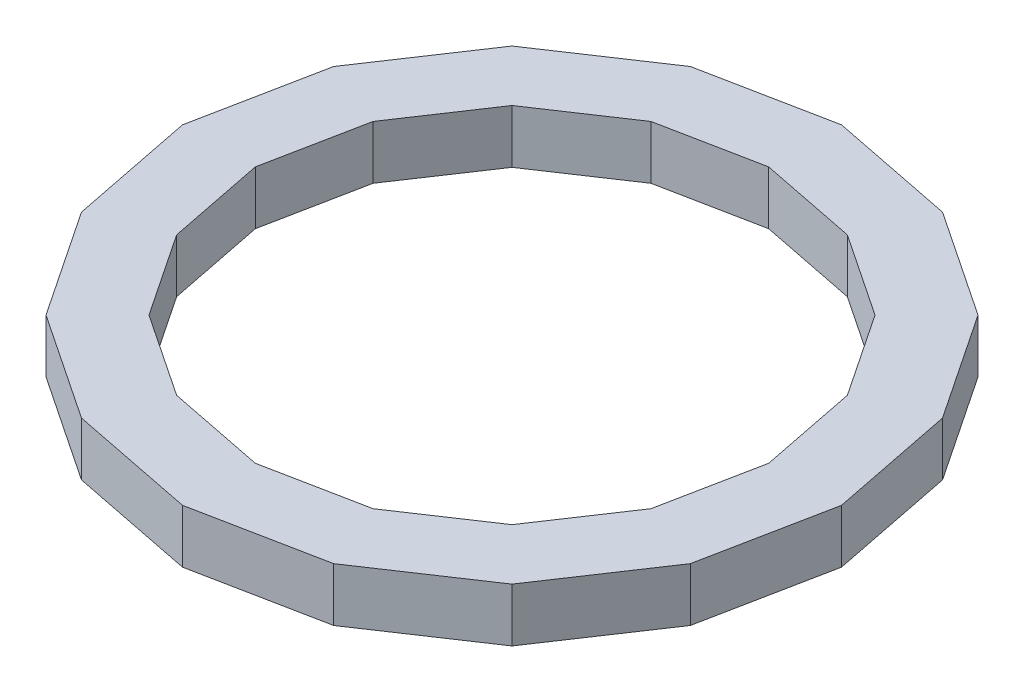
from build123d import *

# Parameters (mm, degrees)
BOSS_EXTRUDE1_DEPTH = 19.05


with BuildPart() as part:
    # Sketch1 → Boss-Extrude1 (new body)
    with BuildSketch(Plane(origin=(0, 0, 0), x_dir=(1, 0, 0), z_dir=(0, 1, 0))):
        Polygon((117.176494271, 0), (108.256964748, 44.84150302), (82.856293695, 82.856293695), (44.84150302, 108.256964748), (0, 117.176494271), (-44.84150302, 108.256964748), (-82.856293695, 82.856293695), (-108.256964748, 44.84150302), (-117.176494271, 0), (-108.256964748, -44.84150302), (-82.856293695, -82.856293695), (-44.84150302, -108.256964748), (0, -117.176494271), (44.84150302, -108.256964748), (82.856293695, -82.856293695), (108.256964748, -44.84150302), align=None)
        Polygon((91.278878852, 0), (84.330687922, 34.930914662), (64.543914216, 64.543914216), (34.930914662, 84.330687922), (0, 91.278878852), (-34.930914662, 84.330687922), (-64.543914216, 64.543914216), (-84.330687922, 34.930914662), (-91.278878852, 0), (-84.330687922, -34.930914662), (-64.543914216, -64.543914216), (-34.930914662, -84.330687922), (0, -91.278878852), (34.930914662, -84.330687922), (64.543914216, -64.543914216), (84.330687922, -34.930914662), align=None, mode=Mode.SUBTRACT)
    extrude(amount=BOSS_EXTRUDE1_DEPTH)


solid = part.part
